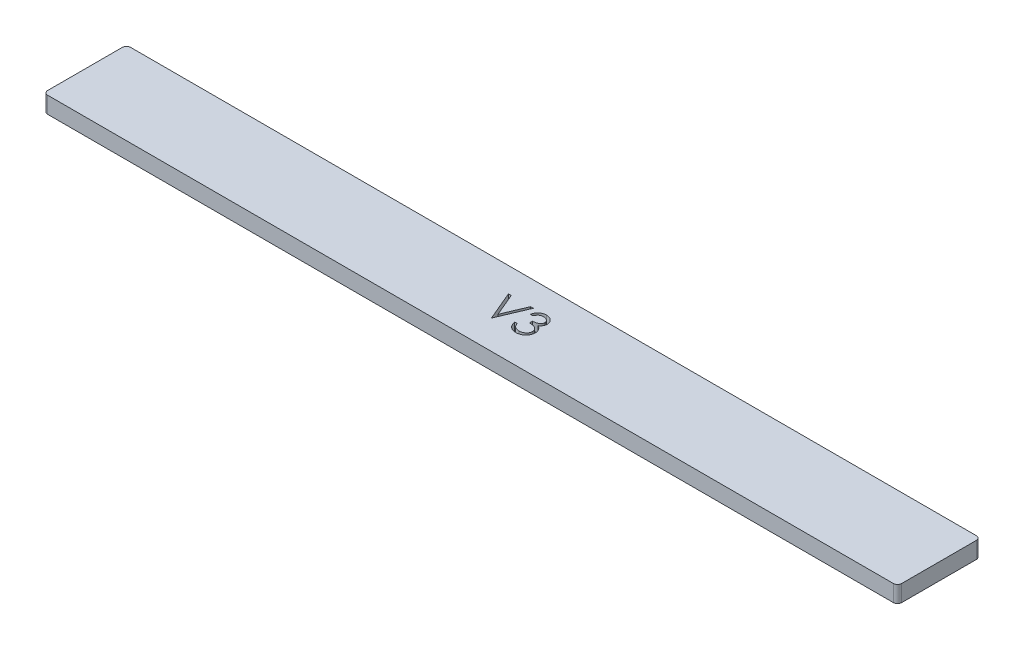
from build123d import *

# Parameters (mm, degrees)
SKETCH1_W           = 99
SKETCH1_H           = 6
BOSS_EXTRUDE1_DEPTH = 2
SKETCH2_W           = 101
SKETCH2_H           = 8
BOSS_EXTRUDE3_DEPTH = 2
DRAFT1_ANGLE        = 10
SKETCH3_W           = 103
SKETCH3_H           = 10
BOSS_EXTRUDE4_DEPTH = 2
FILLET1_R           = 0.5
CUT_EXTRUDE1_DEPTH  = 1
CUT_EXTRUDE2_START  = 10
CUT_EXTRUDE2_DEPTH  = 10


with BuildPart() as part:
    # Sketch1 → Boss-Extrude1 (new body)
    with BuildSketch(Plane(origin=(0, 0, 0), x_dir=(1, 0, 0), z_dir=(0, 1, 0))):
        Rectangle(SKETCH1_W, SKETCH1_H)
    extrude(amount=BOSS_EXTRUDE1_DEPTH)

    # Draft1
    draft1_faces = [part.faces().sort_by_distance(p)[0] for p in [
        (49.5, 1, 0),
        (0, 1, 3),
        (-49.5, 1, 0),
        (0, 1, -3),
    ]]
    draft(draft1_faces, Plane(origin=(0, 0, 0), x_dir=(0, 0, -1), z_dir=(0, -1, 0)), DRAFT1_ANGLE)



with BuildPart() as body_2:
    # Sketch2 → Boss-Extrude3 (new body)
    with BuildSketch(Plane(origin=(0, 2, 0), x_dir=(1, 0, 0), z_dir=(0, 1, 0))):
        Rectangle(SKETCH2_W, SKETCH2_H)
    extrude(amount=BOSS_EXTRUDE3_DEPTH)


with BuildPart() as part_1:
    add(part.part)

    add(body_2.part)  # Boss-Extrude4 merges body 2
    # Sketch3 → Boss-Extrude4 (add)
    with BuildSketch(Plane(origin=(0, 4, 0), x_dir=(1, 0, 0), z_dir=(0, 1, 0))):
        Rectangle(SKETCH3_W, SKETCH3_H)
    extrude(amount=-BOSS_EXTRUDE4_DEPTH)

    # Fillet1
    fillet1_edges = [part_1.edges().sort_by_distance(p)[0] for p in [
        (-51.5, 3, 5),
        (-51.5, 3, -5),
        (51.5, 3, -5),
        (51.5, 3, 5),
    ]]
    fillet(fillet1_edges, radius=FILLET1_R)

    # Sketch4 → Cut-Extrude1 (cut)
    with BuildSketch(Plane(origin=(0, 4, 0), x_dir=(1, 0, 0), z_dir=(0, 1, 0))):
        Polygon((-2.466339169, 2.034069186), (-2.129800707, 2.034069186), (-0.96313404, -0.724143955), (0.203532626, 2.034069186), (0.540071088, 2.034069186), (-0.940698143, -1.465930814), (-0.985569938, -1.465930814), align=None)
        with BuildLine():
            Line((1.302891601, 1.226376878), (0.988789037, 1.226376878))
            add(Edge.make_bspline(
                [(0.988789037, 1.226376878), (0.997298587, 1.261609362), (1.013934063, 1.330485986), (1.048631636, 1.428893247), (1.086430891, 1.522016768), (1.131819996, 1.608112842), (1.18132875, 1.688911745), (1.238051472, 1.762580869), (1.299371194, 1.830993835), (1.367196144, 1.891707072), (1.438324805, 1.946684802), (1.513759425, 1.993559859), (1.591982319, 2.033884012), (1.673535452, 2.067104244), (1.758661623, 2.092129767), (1.846591247, 2.110286573), (1.937554747, 2.122077687), (1.999302337, 2.12322845), (2.030656024, 2.123812775)],
                knots=[0, 0, 0, 0, 1.162005537, 2.271625781, 3.343758855, 4.383309926, 5.390229558, 6.379919256, 7.361854164, 8.333198761, 9.295911338, 10.242430842, 11.177959212, 12.116337295, 13.062827104, 14.020064771, 14.994644689, 16, 16, 16, 16], degree=3))
            add(Edge.make_bspline(
                [(2.030656024, 2.123812775), (2.076338766, 2.122433545), (2.166707777, 2.11970517), (2.299470824, 2.094790733), (2.427497643, 2.055365601), (2.549386891, 2.000891874), (2.662605323, 1.93370456), (2.76334151, 1.853739824), (2.850230021, 1.762540522), (2.923124398, 1.661807958), (2.980199397, 1.554152448), (3.022285771, 1.443352291), (3.047907452, 1.32967032), (3.051228009, 1.252913041), (3.052891601, 1.214457807)],
                knots=[0, 0, 0, 0, 1.083050992, 2.142477498, 3.193116406, 4.255571735, 5.30263384, 6.308962982, 7.297363603, 8.282367274, 9.249857812, 10.179914175, 11.08814088, 12, 12, 12, 12], degree=3))
            add(Edge.make_bspline(
                [(3.052891601, 1.214457807), (3.05172801, 1.177451013), (3.049451043, 1.105034458), (3.030117337, 0.999312961), (2.997581074, 0.899671361), (2.952511311, 0.805690199), (2.894169761, 0.717965359), (2.823497064, 0.636299468), (2.739994403, 0.56033031), (2.676715465, 0.516810837), (2.644137594, 0.494405724)],
                knots=[0, 0, 0, 0, 1.024540389, 2.004866551, 2.965041327, 3.920577974, 4.882998113, 5.874504559, 6.905732034, 8, 8, 8, 8], degree=3))
            add(Edge.make_bspline(
                [(2.644137594, 0.494405724), (2.681369349, 0.476427552), (2.755136223, 0.440807595), (2.855686753, 0.370951837), (2.946964628, 0.29029549), (2.997868347, 0.227352837), (3.023444485, 0.195727839)],
                knots=[0, 0, 0, 0, 1.015518401, 2.012035669, 3.001164323, 4, 4, 4, 4], degree=3))
            add(Edge.make_bspline(
                [(3.023444485, 0.195727839), (3.040285828, 0.172670088), (3.073692724, 0.126932171), (3.114928257, 0.053395745), (3.152337372, -0.020955744), (3.181487591, -0.09811515), (3.204061458, -0.177188164), (3.22019749, -0.25831056), (3.230221631, -0.341548582), (3.231657183, -0.397861062), (3.23237878, -0.426167193)],
                knots=[0, 0, 0, 0, 1.025084078, 2.033381695, 3.024893161, 4.013698104, 4.991890475, 5.976764909, 6.982997093, 8, 8, 8, 8], degree=3))
            add(Edge.make_bspline(
                [(3.23237878, -0.426167193), (3.230584267, -0.475176914), (3.227003685, -0.572965716), (3.19499961, -0.717440437), (3.14538637, -0.85866594), (3.074929434, -0.993740779), (2.989061925, -1.12012116), (2.886904601, -1.233197469), (2.769618192, -1.330396073), (2.638812543, -1.411606301), (2.497095415, -1.476524223), (2.345519823, -1.521581666), (2.186269769, -1.550927666), (2.077062471, -1.554074535), (2.02154144, -1.555674404)],
                knots=[0, 0, 0, 0, 0.955779014, 1.907060117, 2.875433937, 3.871313158, 4.872415639, 5.851225146, 6.836215519, 7.83643374, 8.849228613, 9.86973379, 10.916971861, 12, 12, 12, 12], degree=3))
            add(Edge.make_bspline(
                [(2.02154144, -1.555674404), (1.98412214, -1.554806191), (1.910493435, -1.553097837), (1.802249937, -1.541419236), (1.698928237, -1.52008923), (1.600388639, -1.491385925), (1.506543603, -1.454994183), (1.417679498, -1.409675485), (1.333249604, -1.356363983), (1.254050653, -1.294430395), (1.180092086, -1.225149055), (1.113339361, -1.147290045), (1.052679568, -1.062292641), (0.99973693, -0.969169585), (0.952099977, -0.869124328), (0.91291902, -0.76087583), (0.878433452, -0.645391808), (0.862399987, -0.564914067), (0.854173652, -0.523623122)],
                knots=[0, 0, 0, 0, 1.048658725, 2.063410685, 3.046034179, 4.001477787, 4.936774919, 5.862367409, 6.792675028, 7.730719943, 8.675894397, 9.627829632, 10.600096036, 11.597688215, 12.626045268, 13.701542398, 14.82072376, 16, 16, 16, 16], degree=3))
            Line((0.854173652, -0.523623122), (1.168276216, -0.523623122))
            add(Edge.make_bspline(
                [(1.168276216, -0.523623122), (1.176459507, -0.550572135), (1.19237672, -0.602990307), (1.219471018, -0.678430613), (1.25033929, -0.747588666), (1.283453849, -0.810971788), (1.318232295, -0.86920419), (1.35714722, -0.920746059), (1.397316365, -0.967861262), (1.427595719, -0.994405874), (1.442414838, -1.007397161)],
                knots=[0, 0, 0, 0, 1.198163088, 2.33053128, 3.407730985, 4.417276592, 5.372219308, 6.28897303, 7.162600585, 8, 8, 8, 8], degree=3))
            add(Edge.make_bspline(
                [(1.442414838, -1.007397161), (1.462011414, -1.022505495), (1.501144077, -1.052675526), (1.564912308, -1.091177155), (1.631977194, -1.12453818), (1.703791869, -1.150021876), (1.778806639, -1.171599537), (1.858234004, -1.185720056), (1.941373221, -1.195408227), (1.998140985, -1.196263159), (2.027150415, -1.196700045)],
                knots=[0, 0, 0, 0, 0.946170439, 1.889420265, 2.845303464, 3.807233317, 4.801018734, 5.828864929, 6.890507805, 8, 8, 8, 8], degree=3))
            add(Edge.make_bspline(
                [(2.027150415, -1.196700045), (2.059903917, -1.19608414), (2.123950564, -1.19487979), (2.217405424, -1.183804084), (2.306312871, -1.16767367), (2.389685797, -1.142760687), (2.468616304, -1.111979836), (2.541997954, -1.07333143), (2.61079406, -1.027986709), (2.674123466, -0.97644755), (2.731068973, -0.920026055), (2.781208486, -0.861012984), (2.823833148, -0.799657154), (2.858216726, -0.735619034), (2.885367276, -0.669163805), (2.903850477, -0.600104975), (2.916701992, -0.529007709), (2.917748604, -0.48067874), (2.918276216, -0.45631543)],
                knots=[0, 0, 0, 0, 1.217147791, 2.380027433, 3.494444702, 4.572153297, 5.609568379, 6.639424714, 7.649109417, 8.668170816, 9.669597737, 10.625200337, 11.543417969, 12.441394052, 13.322311151, 14.205496177, 15.095365482, 16, 16, 16, 16], degree=3))
            add(Edge.make_bspline(
                [(2.918276216, -0.45631543), (2.916745915, -0.423704091), (2.913692926, -0.358643683), (2.890384347, -0.262926108), (2.852045482, -0.170702696), (2.798372971, -0.083546906), (2.733037242, -0.002771004), (2.656672336, 0.069300478), (2.568644107, 0.128770569), (2.487624238, 0.169859226), (2.415859082, 0.197896301), (2.354443697, 0.216571265), (2.285687094, 0.232384921), (2.210420745, 0.247097192), (2.128077529, 0.259618541), (2.038747091, 0.270060356), (1.942411329, 0.278415397), (1.875720163, 0.282146492), (1.841353139, 0.284069186)],
                knots=[0, 0, 0, 0, 1.07054697, 2.135767047, 3.216561865, 4.33974944, 5.486079747, 6.621378074, 7.775625952, 8.963672916, 9.598146892, 10.304877434, 11.070270905, 11.915000392, 12.823868403, 13.805723172, 14.86925407, 16, 16, 16, 16], degree=3))
            Line((1.841353139, 0.284069186), (1.841353139, 0.643043545))
            add(Edge.make_bspline(
                [(1.841353139, 0.643043545), (1.884654305, 0.643778348), (1.969470651, 0.645217648), (2.093364956, 0.662625659), (2.211838268, 0.686706287), (2.32226501, 0.723591479), (2.422913724, 0.766431776), (2.510233326, 0.816283985), (2.583000473, 0.871698735), (2.640861544, 0.933531344), (2.684390773, 0.999846391), (2.716217571, 1.068963049), (2.735017897, 1.14148711), (2.737527564, 1.190981778), (2.738789037, 1.215860051)],
                knots=[0, 0, 0, 0, 1.321986639, 2.589447074, 3.816329219, 5.01088745, 6.139805852, 7.153945165, 8.075214402, 8.924034688, 9.728124013, 10.488707548, 11.240355623, 12, 12, 12, 12], degree=3))
            add(Edge.make_bspline(
                [(2.738789037, 1.215860051), (2.738374626, 1.234137796), (2.737550175, 1.270500503), (2.727152897, 1.323625572), (2.711528856, 1.375126518), (2.690049127, 1.424784328), (2.661298928, 1.472254602), (2.626892941, 1.517942051), (2.585924841, 1.56158583), (2.538979394, 1.602266149), (2.488567589, 1.641035387), (2.433317814, 1.673949024), (2.374895939, 1.702094086), (2.313237284, 1.725303588), (2.248141754, 1.742762876), (2.179915196, 1.755298717), (2.108427513, 1.763136372), (2.059655781, 1.764264788), (2.034862755, 1.764838416)],
                knots=[0, 0, 0, 0, 0.884392785, 1.759457502, 2.611959086, 3.489218968, 4.37281399, 5.2945488, 6.255912374, 7.266815255, 8.301784654, 9.332968512, 10.37626691, 11.440494194, 12.520033166, 13.637162961, 14.798855837, 16, 16, 16, 16], degree=3))
            add(Edge.make_bspline(
                [(2.034862755, 1.764838416), (1.995011087, 1.763447054), (1.91717151, 1.760729401), (1.804956593, 1.736926387), (1.700637259, 1.698948304), (1.620898593, 1.653615284), (1.562016018, 1.60886485), (1.51993908, 1.569782464), (1.47861857, 1.52634964), (1.440772893, 1.475891265), (1.402498916, 1.421824475), (1.367654355, 1.361400793), (1.333794663, 1.296196399), (1.313392113, 1.250100765), (1.302891601, 1.226376878)],
                knots=[0, 0, 0, 0, 1.472543308, 2.876219568, 4.221790263, 5.565193594, 6.249813518, 6.953379497, 7.687249741, 8.463570142, 9.283606569, 10.136032583, 11.040678096, 12, 12, 12, 12], degree=3))
        make_face()
    extrude(amount=-CUT_EXTRUDE1_DEPTH, mode=Mode.SUBTRACT)

    # Sketch5 → Cut-Extrude2 (cut)
    with BuildSketch(Plane.XZ.offset(-2).offset(CUT_EXTRUDE2_START)):
        with BuildLine():
            Line((-51.5, 4.5), (-51.5, -4.5))
            ThreePointArc((-51.5, -4.5), (-51.353553391, -4.853553391), (-51, -5))
            Line((-51, -5), (51, -5))
            ThreePointArc((51, -5), (51.353553391, -4.853553391), (51.5, -4.5))
            Line((51.5, -4.5), (51.5, 4.5))
            ThreePointArc((51.5, 4.5), (51.353553391, 4.853553391), (51, 5))
            Line((51, 5), (-51, 5))
            ThreePointArc((-51, 5), (-51.353553391, 4.853553391), (-51.5, 4.5))
        make_face()
    extrude(amount=-CUT_EXTRUDE2_DEPTH, mode=Mode.SUBTRACT)


solid = part_1.part
